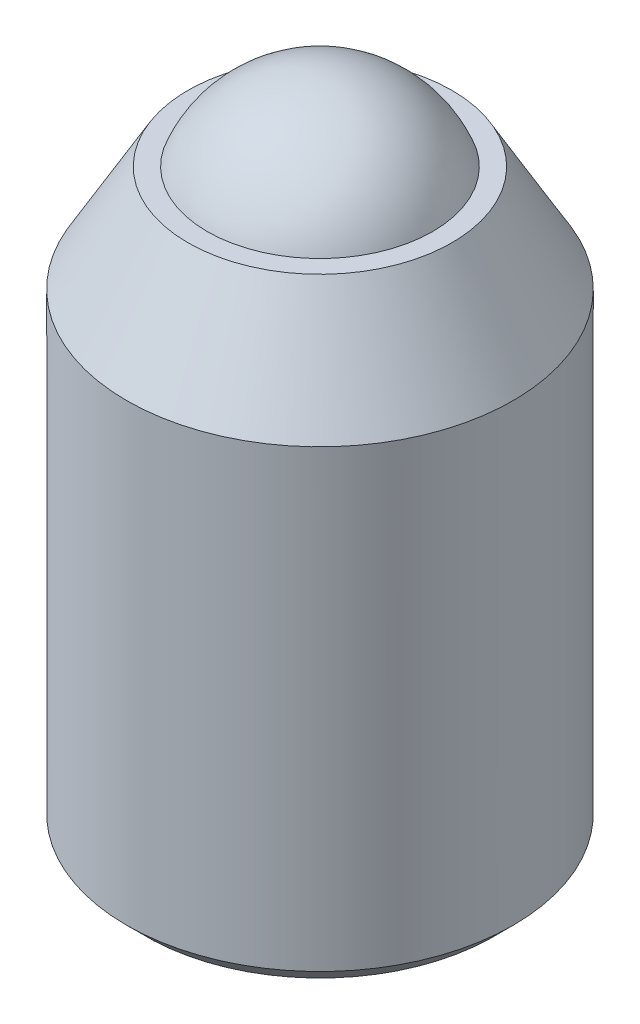
from build123d import *

# Parameters (mm, degrees)
CHAMFER_1_SIZE      = 0.2
CUT_EXTRUDE_1_DEPTH = 1.5
CHAMFER_3_SIZE      = 0.25


with BuildPart() as part:
    # Эскиз1 → Повернуть1 (revolve)
    with BuildSketch(Plane.XY, mode=Mode.PRIVATE) as revolve_1_sk:
        with BuildLine():
            Line((0, 0), (-2, 0))
            Line((-2, 0), (-2, 4.902209534))
            Line((-2, 4.902209534), (-1.366190379, 6))
            Line((-1.366190379, 6), (-1.166190379, 6))
            ThreePointArc((-1.166190379, 6), (-0.707106781, 6.580776406), (0, 6.8))
            Line((0, 6.8), (0, 0))
        make_face()
    revolve(revolve_1_sk.sketch.rotate(Axis((0, 6.8, 0), (0, -1, 0)), 270), axis=Axis((0, 6.8, 0), (0, -1, 0)))

    # Фаска1
    chamfer_1_edges = [part.edges().sort_by_distance(p)[0] for p in [
        (0, 0, -2),
    ]]
    chamfer(chamfer_1_edges, length=CHAMFER_1_SIZE)

    # Эскиз2 → Вырез-Вытянуть1 (cut)
    with BuildSketch(Plane.XZ):
        Polygon((1.154700538, 0), (0.577350269, 1), (-0.577350269, 1), (-1.154700538, 0), (-0.577350269, -1), (0.577350269, -1), align=None)
    extrude(amount=-CUT_EXTRUDE_1_DEPTH, mode=Mode.SUBTRACT)

    # Фаска3
    chamfer_3_edges = [part.edges().sort_by_distance(p)[0] for p in [
        (0.8660254037844386, 0, -0.5000000000000002),
        (0.8660254037844386, 0, 0.5000000000000007),
        (0, 0, 1),
        (-0.8660254037844393, 0, 0.5000000000000004),
        (-0.8660254037844393, 0, -0.5000000000000003),
        (0, 0, -1),
    ]]
    chamfer(chamfer_3_edges, length=CHAMFER_3_SIZE)


solid = part.part
